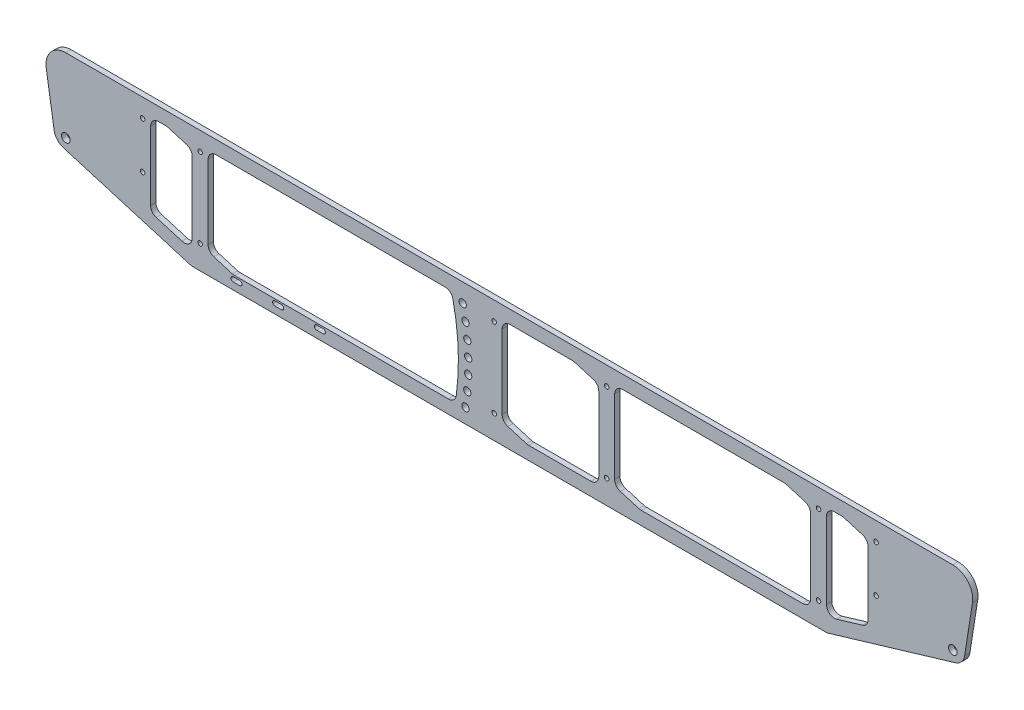
from build123d import *

# Parameters (mm, degrees)
SKETCH_1_R          = 3.25
EXTRUDE_1_DEPTH     = 4
HOLE_WIZARD_M52_D   = 5.5
HOLE_WIZARD_M53_D   = 5.5
FILLET_5_R          = 10
CUT_EXTRUDE_4_DEPTH = 354.032576401
FILLET_7_R          = 6
HOLE_WIZARD_M34_D   = 3.4
CUT_EXTRUDE_5_DEPTH = 354.032576401


with BuildPart() as part:
    # Эскиз1 → Бобышка-Вытянуть1 (new body)
    with BuildSketch(Plane.XY):
        with BuildLine():
            Line((-349.818316726, 28.672449915), (-342.910885265, -15.303620822))
            Line((-342.910885265, -15.303620822), (-240, -46))
            Line((-240, -46), (240, -46))
            Line((240, -46), (342.910885265, -15.303620822))
            Line((342.910885265, -15.303620822), (349.818316726, 28.672449915))
            ThreePointArc((349.818316726, 28.672449915), (346.399852001, 40.749019149), (335, 46))
            Line((335, 46), (-335, 46))
            ThreePointArc((-335, 46), (-346.399852001, 40.749019149), (-349.818316726, 28.672449915))
        make_face()
        with Locations((-335, -9.635315981)):
            Circle(SKETCH_1_R, mode=Mode.SUBTRACT)
        with Locations(Location((335, -9.635315981, 0), (0, 0, 180))):
            Circle(SKETCH_1_R, mode=Mode.SUBTRACT)
    extrude(amount=EXTRUDE_1_DEPTH)

    # Отверстие с зазором M52 (through all)
    with Locations(Plane(origin=(0, 0, 0), x_dir=(-1, 0, 0), z_dir=(0, 0, -1))):
        with Locations((215, -7)):
            Hole(HOLE_WIZARD_M52_D / 2)

    # Отверстие с зазором M53 (through all)
    with Locations(Plane(origin=(0, 0, 0), x_dir=(-1, 0, 0), z_dir=(0, 0, -1))):
        with Locations((31.771314746, 9.83), (35.189476411, 32.040691677), (33.141482074, 20.990703059), (31.085819286, -1.380913569), (31.085819286, -12.619086431), (31.771893326, -23.836297834), (33.141482074, -34.990703059)):
            Hole(HOLE_WIZARD_M53_D / 2)

    # Скругление5
    fillet_5_edges = [part.edges().sort_by_distance(p)[0] for p in [
        (342.910885265, -15.303620822, 2),
        (240, -46, 2),
        (-240, -46, 2),
        (-342.910885265, -15.303620822, 2),
    ]]
    fillet(fillet_5_edges, radius=FILLET_5_R)

    # Эскиз22 → Вырез-Вытянуть4 (cut, through all)
    with BuildSketch(Plane(origin=(0, 0, 0), x_dir=(-1, 0, 0), z_dir=(0, 0, -1))):
        Polygon((-227.540368898, -36), (-98.70593747, -36), (-79.540368898, -30.283271798), (-79.540368898, 36), (-208.374800326, 36), (-227.540368898, 30.283271798), align=None)
        with BuildLine():
            Line((227.54, -30.283271798), (208.374431428, -36))
            Line((208.374431428, -36), (40.898736363, -36))
            ThreePointArc((40.898736363, -36), (38.644905491, 0.150569256), (43.818079226, 36))
            Line((43.818079226, 36), (227.54, 36))
            Line((227.54, 36), (227.54, -30.283271798))
        make_face()
        Polygon((-271, 30.283271798), (-251.834431428, 36), (-239.540368898, 36), (-239.540368898, -35.701718831), (-271, -26.317903284), align=None)
        Polygon((-67.540368898, -36), (-13.70593747, -36), (5.459631102, -30.283271798), (5.459631102, 36), (-48.374800326, 36), (-67.540368898, 30.283271798), align=None)
        Polygon((239.54, 30.283271798), (258.705568572, 36), (271, 36), (271, -26.317903284), (239.54, -35.701828866), align=None)
    extrude(amount=-CUT_EXTRUDE_4_DEPTH, mode=Mode.SUBTRACT)

    # Скругление7
    fillet_7_edges = [part.edges().sort_by_distance(p)[0] for p in [
        (227.540368898, -36, 2),
        (227.540368898, 30.283271798, 2),
        (208.374800326, 36, 2),
        (79.540368898, 36, 2),
        (79.540368898, -30.283271798, 2),
        (98.70593747, -36, 2),
        (271, -26.317903284, 2),
        (271, 30.283271798, 2),
        (251.834431428, 36, 2),
        (239.540368898, 36, 2),
        (239.540368898, -35.701718831, 2),
        (-40.898736363, -36, 2),
        (-43.818079226, 36, 2),
        (-227.54, 36, 2),
        (-227.54, -30.283271798, 2),
        (-208.374431428, -36, 2),
        (67.540368898, -36, 2),
        (67.540368898, 30.283271798, 2),
        (48.374800326, 36, 2),
        (-5.459631102, 36, 2),
        (-5.459631102, -30.283271798, 2),
        (13.70593747, -36, 2),
        (-271, -26.317903284, 2),
        (-239.54, -35.701828866, 2),
        (-239.54, 30.283271798, 2),
        (-258.705568572, 36, 2),
        (-271, 36, 2),
    ]]
    fillet(fillet_7_edges, radius=FILLET_7_R)

    # Отверстие с зазором M34 (through all)
    with Locations(Plane(origin=(0, 0, 0), x_dir=(-1, 0, 0), z_dir=(0, 0, -1))):
        with Locations((-233.540368898, 32), (-233.540368898, -28), (-73.540368898, -28), (-73.540368898, 32), (11.459631102, 32), (11.459631102, -28), (277, 32), (277, -3), (-277, 32), (-277, -3), (233.54, -28), (233.54, 32)):
            Hole(HOLE_WIZARD_M34_D / 2)

    # Эскиз25 → Вырез-Вытянуть5 (cut, through all)
    with BuildSketch(Plane.XY.offset(4)):
        with BuildLine():
            Line((-208.641482074, -37.3), (-203.641482074, -37.3))
            ThreePointArc((-203.641482074, -37.3), (-201.941482074, -39), (-203.641482074, -40.7))
            Line((-203.641482074, -40.7), (-208.641482074, -40.7))
            ThreePointArc((-208.641482074, -40.7), (-210.341482074, -39), (-208.641482074, -37.3))
        make_face()
        with BuildLine():
            Line((-177.141482074, -37.3), (-172.141482074, -37.3))
            ThreePointArc((-172.141482074, -37.3), (-170.441482074, -39), (-172.141482074, -40.7))
            Line((-172.141482074, -40.7), (-177.141482074, -40.7))
            ThreePointArc((-177.141482074, -40.7), (-178.841482074, -39), (-177.141482074, -37.3))
        make_face()
        with BuildLine():
            Line((-140.641482074, -40.7), (-145.641482074, -40.7))
            ThreePointArc((-145.641482074, -40.7), (-147.341482074, -39), (-145.641482074, -37.3))
            Line((-145.641482074, -37.3), (-140.641482074, -37.3))
            ThreePointArc((-140.641482074, -37.3), (-138.941482074, -39), (-140.641482074, -40.7))
        make_face()
    extrude(amount=-CUT_EXTRUDE_5_DEPTH, mode=Mode.SUBTRACT)


solid = part.part
